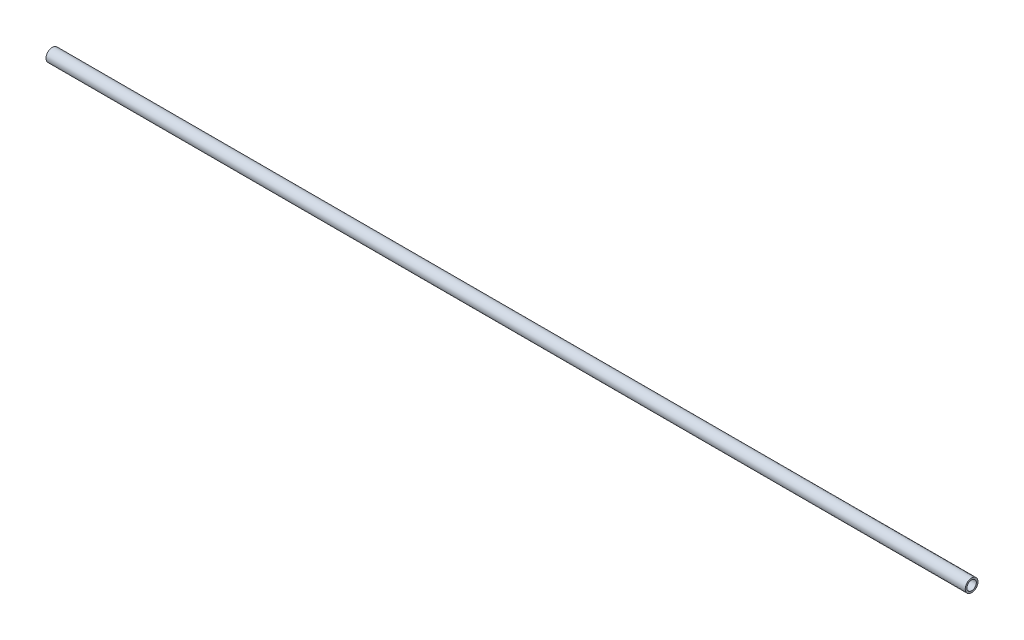
from build123d import *

# Parameters (mm, degrees)
SKETCH1_R      = 6.35
SKETCH1_R_2    = 4.699
EXTRUDE1_DEPTH = 457.2


with BuildPart() as part:
    # Sketch1 → Extrude1 (new, symmetric)
    with BuildSketch(Plane(origin=(0, 0, 0), x_dir=(0, 0, -1), z_dir=(1, 0, 0))):
        Circle(SKETCH1_R)
        Circle(SKETCH1_R_2, mode=Mode.SUBTRACT)
    extrude(amount=EXTRUDE1_DEPTH, both=True)


solid = part.part
